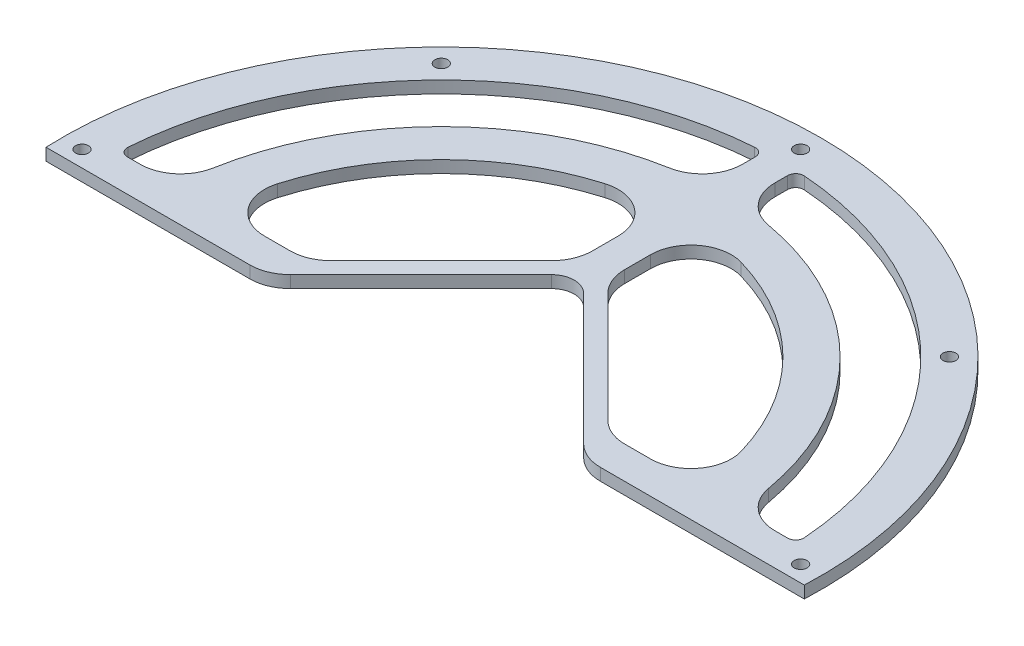
from build123d import *

# Parameters (mm, degrees)
SKETCH_1_R      = 1.6
EXTRUDE_1_DEPTH = 3


with BuildPart() as part:
    # 草图1 → 凸台-拉伸1 (new body)
    with BuildSketch(Plane(origin=(0, 0, 0), x_dir=(1, 0, 0), z_dir=(0, 1, 0))):
        with BuildLine():
            Line((-31.220966692, 4), (-36.292034504, -1.071067812))
            ThreePointArc((-36.292034504, -1.071067812), (-39.536267992, -3.238795325), (-43.363102316, -4))
            Line((-43.363102316, -4), (-46.95, -4))
            Line((-46.95, -4), (-83.804594146, -4))
            Line((-83.804594146, -4), (-93.814764296, -4))
            ThreePointArc((-93.814764296, -4), (0, 93.9), (93.814764296, -4))
            Line((93.814764296, -4), (83.804594146, -4))
            Line((83.804594146, -4), (46.95, -4))
            Line((46.95, -4), (43.363102316, -4))
            ThreePointArc((43.363102316, -4), (39.536267992, -3.238795325), (36.292034504, -1.071067812))
            Line((36.292034504, -1.071067812), (31.220966692, 4))
            Line((31.220966692, 4), (4, 31.220966692))
            ThreePointArc((4, 31.220966692), (0, 32.877820942), (-4, 31.220966692))
            Line((-4, 31.220966692), (-31.220966692, 4))
        make_face()
        with Locations(Location((88.9, 0, 0), (0, 0, 270))):
            Circle(SKETCH_1_R, mode=Mode.SUBTRACT)
        with Locations(Location((-88.9, 0, 0), (0, 0, 270))):
            Circle(SKETCH_1_R, mode=Mode.SUBTRACT)
        with Locations(Location((-62.861792847, 62.861792847, 0), (0, 0, 270))):
            Circle(SKETCH_1_R, mode=Mode.SUBTRACT)
        with Locations(Location((0, 88.9, 0), (0, 0, 270))):
            Circle(SKETCH_1_R, mode=Mode.SUBTRACT)
        with Locations(Location((62.861792847, 62.861792847, 0), (0, 0, 270))):
            Circle(SKETCH_1_R, mode=Mode.SUBTRACT)
        with BuildLine():
            Line((46.95, 4), (47.760369555, 4))
            ThreePointArc((47.760369555, 4), (55.764412134, 8.005393892), (57.356586062, 16.812939522))
            ThreePointArc((57.356586062, 16.812939522), (42.263772312, 42.263772312), (16.812939522, 57.356586062))
            ThreePointArc((16.812939522, 57.356586062), (8.005393892, 55.764412134), (4, 47.760369555))
            Line((4, 47.760369555), (4, 46.95))
            Line((4, 46.95), (4, 41.363102316))
            ThreePointArc((4, 41.363102316), (4.761204675, 37.536267992), (6.928932188, 34.292034504))
            Line((6.928932188, 34.292034504), (34.292034504, 6.928932188))
            ThreePointArc((34.292034504, 6.928932188), (37.536267992, 4.761204675), (41.363102316, 4))
            Line((41.363102316, 4), (46.95, 4))
        make_face(mode=Mode.SUBTRACT)
        with BuildLine():
            Line((-46.95, 4), (-41.363102316, 4))
            ThreePointArc((-41.363102316, 4), (-37.536267992, 4.761204675), (-34.292034504, 6.928932188))
            Line((-34.292034504, 6.928932188), (-6.928932188, 34.292034504))
            ThreePointArc((-6.928932188, 34.292034504), (-4.761204675, 37.536267992), (-4, 41.363102316))
            Line((-4, 41.363102316), (-4, 46.95))
            Line((-4, 46.95), (-4, 47.760369555))
            ThreePointArc((-4, 47.760369555), (-8.005393892, 55.764412134), (-16.812939522, 57.356586062))
            ThreePointArc((-16.812939522, 57.356586062), (-42.263772312, 42.263772312), (-57.356586062, 16.812939522))
            ThreePointArc((-57.356586062, 16.812939522), (-55.764412134, 8.005393892), (-47.760369555, 4))
            Line((-47.760369555, 4), (-46.95, 4))
        make_face(mode=Mode.SUBTRACT)
        with BuildLine():
            Line((-78.53185914, 4), (-81.679924094, 4))
            ThreePointArc((-81.679924094, 4), (-83.145024823, 4.638574331), (-83.674549835, 6.146520147))
            ThreePointArc((-83.674549835, 6.146520147), (-59.326258942, 59.326258942), (-6.146520147, 83.674549835))
            ThreePointArc((-6.146520147, 83.674549835), (-4.638574331, 83.145024823), (-4, 81.679924094))
            Line((-4, 81.679924094), (-4, 78.53185914))
            ThreePointArc((-4, 78.53185914), (-6.333499574, 72.111207209), (-12.244954243, 68.687072987))
            ThreePointArc((-12.244954243, 68.687072987), (-49.334840123, 49.334840123), (-68.687072987, 12.244954243))
            ThreePointArc((-68.687072987, 12.244954243), (-72.111207209, 6.333499574), (-78.53185914, 4))
        make_face(mode=Mode.SUBTRACT)
        with BuildLine():
            Line((4, 78.53185914), (4, 81.679924094))
            ThreePointArc((4, 81.679924094), (4.638574331, 83.145024823), (6.146520147, 83.674549835))
            ThreePointArc((6.146520147, 83.674549835), (59.326258942, 59.326258942), (83.674549835, 6.146520147))
            ThreePointArc((83.674549835, 6.146520147), (83.145024823, 4.638574331), (81.679924094, 4))
            Line((81.679924094, 4), (78.53185914, 4))
            ThreePointArc((78.53185914, 4), (72.111207209, 6.333499574), (68.687072987, 12.244954243))
            ThreePointArc((68.687072987, 12.244954243), (49.334840123, 49.334840123), (12.244954243, 68.687072987))
            ThreePointArc((12.244954243, 68.687072987), (6.333499574, 72.111207209), (4, 78.53185914))
        make_face(mode=Mode.SUBTRACT)
    extrude(amount=EXTRUDE_1_DEPTH)


solid = part.part
